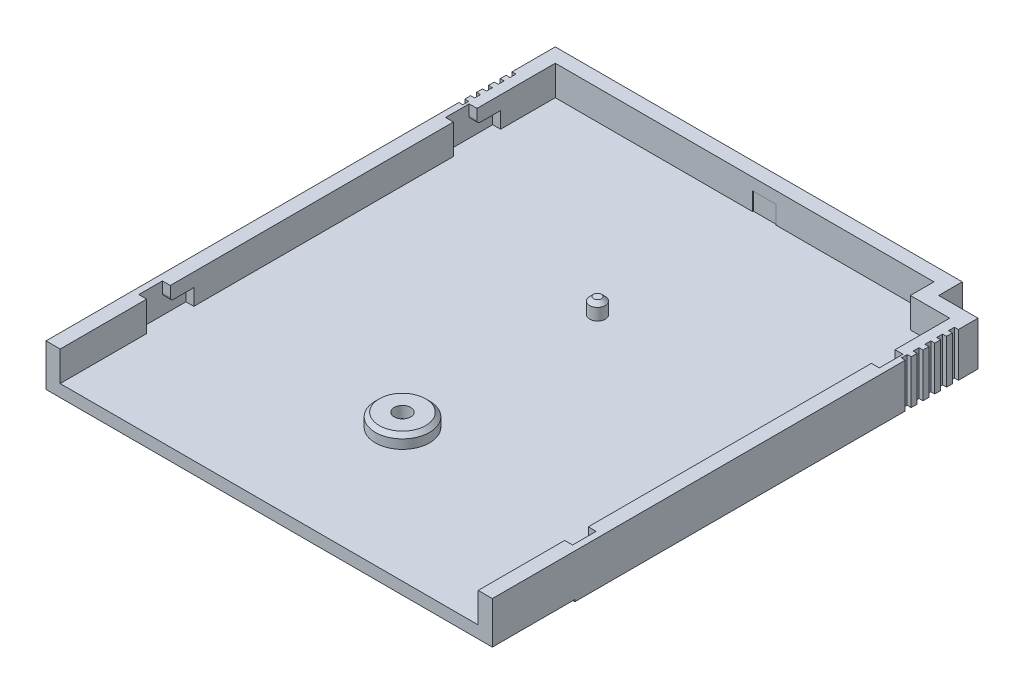
from build123d import *

# Parameters (mm, degrees)
BOSS_EXTRUDE1_DEPTH  = 5.6
SHELL1_T             = -1.8
CUT_EXTRUDE1_REACH   = 72.916
SKETCH2_W            = 53.15
SKETCH2_H            = 3.8
SKETCH3_W            = 0.5
SKETCH3_H            = 0.75
CUT_EXTRUDE2_DEPTH   = 5.6
LPATTERN1_COUNT      = 5
LPATTERN1_PITCH      = 1.5
SKETCH4_R            = 3.45
SKETCH4_R_2          = 1.05
BOSS_EXTRUDE2_DEPTH  = 1.66
SKETCH5_R            = 1
BOSS_EXTRUDE3_DEPTH  = 2
CHAMFER1_SIZE        = 0.5
SKETCH6_R            = 2.5
CUT_EXTRUDE3_DEPTH   = 2
CUT_EXTRUDE4_DEPTH   = 1
LPATTERN2_COUNT      = 2
LPATTERN2_PITCH      = 39
MIRROR1_COPY_1_DEPTH = 1
SKETCH8_W            = 56.75
SKETCH8_H            = 10.5
CUT_EXTRUDE5_DEPTH   = 0.25
SKETCH9_W            = 3
SKETCH9_H            = 54.25
CUT_EXTRUDE6_DEPTH   = 0.1
SKETCH10_W           = 20
SKETCH10_H           = 3
CUT_EXTRUDE7_DEPTH   = 0.1
SKETCH11_W           = 3
SKETCH11_H           = 2.3
CUT_EXTRUDE8_DEPTH   = 0.1


with BuildPart() as part:
    # Sketch1 → Boss-Extrude1 (new body)
    with BuildSketch(Plane(origin=(0, 0, 0), x_dir=(1, 0, 0), z_dir=(0, 1, 0))):
        Polygon((23.375, 32.375), (-28.375, 32.375), (-28.375, -32.375), (28.375, -32.375), (28.375, 29.375), (23.375, 29.375), align=None)
    extrude(amount=BOSS_EXTRUDE1_DEPTH)

    # Shell1
    shell1_openings = [part.faces().sort_by_distance(p)[0] for p in [
        (-0.10605776, 5.6, 0.126552013),
    ]]
    offset(amount=SHELL1_T, openings=shell1_openings, kind=Kind.INTERSECTION)

    # Sketch2 → Cut-Extrude1 (cut, up to next)
    with BuildSketch(Plane.XY.offset(32.375), mode=Mode.PRIVATE) as cut_extrude1_sk1:
        with Locations((0, 3.7)):
            Rectangle(SKETCH2_W, SKETCH2_H)
    cut_extrude1_tool1 = extrude(cut_extrude1_sk1.sketch, amount=-CUT_EXTRUDE1_REACH, mode=Mode.PRIVATE) & part.part
    add(cut_extrude1_tool1.solids().sort_by_distance((0, 3.7, 32.375))[0], mode=Mode.SUBTRACT)

    # Sketch3 → Cut-Extrude2 (cut)
    with BuildSketch(Plane.XZ):
        with Locations((-28.125, -26.5)):
            Rectangle(SKETCH3_W, SKETCH3_H)
        with Locations((28.125, -26.5)):
            Rectangle(SKETCH3_W, SKETCH3_H)
    cut_extrude2 = extrude(amount=-CUT_EXTRUDE2_DEPTH, mode=Mode.SUBTRACT)

    # LPattern1: Cut-Extrude2 ×5
    with Locations(*[(0, 0, i * LPATTERN1_PITCH) for i in range(1, LPATTERN1_COUNT)]):
        add(cut_extrude2, mode=Mode.SUBTRACT)

    # Sketch4 → Boss-Extrude2 (add)
    with BuildSketch(Plane(origin=(0, 1.8, 0), x_dir=(1, 0, 0), z_dir=(0, 1, 0))):
        with Locations(Location((0, -15.425, 0), (0, 0, 90))):
            Circle(SKETCH4_R)
        with Locations(Location((0, -15.425, 0), (0, 0, 90))):
            Circle(SKETCH4_R_2, mode=Mode.SUBTRACT)
    extrude(amount=BOSS_EXTRUDE2_DEPTH)

    # Sketch5 → Boss-Extrude3 (add)
    with BuildSketch(Plane(origin=(0, 1.8, 0), x_dir=(1, 0, 0), z_dir=(0, 1, 0))):
        with Locations(Location((0, 9.375, 0), (0, 0, 90))):
            Circle(SKETCH5_R)
    extrude(amount=BOSS_EXTRUDE3_DEPTH)

    # Chamfer1
    chamfer1_edges = [part.edges().sort_by_distance(p)[0] for p in [
        (0, 3.46, 18.875),
        (0, 3.8, -8.375),
    ]]
    chamfer(chamfer1_edges, length=CHAMFER1_SIZE)

    # Sketch6 → Cut-Extrude3 (cut)
    with BuildSketch(Plane.XZ):
        with Locations(Location((0, 15.425, 0), (0, 0, 270))):
            Circle(SKETCH6_R)
    extrude(amount=-CUT_EXTRUDE3_DEPTH, mode=Mode.SUBTRACT)

    # Sketch7 → Cut-Extrude4 (cut)
    with BuildSketch(Plane.ZY.offset(-26.575)):
        with BuildLine():
            Line((15.375, 3.866149972), (15.375, 1.8))
            Line((15.375, 1.8), (21.375, 1.8))
            Line((21.375, 1.8), (21.375, 5.6))
            Line((21.375, 5.6), (18.375, 5.6))
            Line((18.375, 5.6), (18.375, 4.266149972))
            ThreePointArc((18.375, 4.266149972), (18.257842712, 3.98330726), (17.975, 3.866149972))
            Line((17.975, 3.866149972), (15.375, 3.866149972))
        make_face()
    cut_extrude4 = extrude(amount=-CUT_EXTRUDE4_DEPTH, mode=Mode.SUBTRACT)

    # LPattern2: Cut-Extrude4 ×2
    with Locations(*[(0, 0, -i * LPATTERN2_PITCH) for i in range(1, LPATTERN2_COUNT)]):
        add(cut_extrude4, mode=Mode.SUBTRACT)

    # Mirror1: Cut-Extrude4 across plane
    add(cut_extrude4.mirror(Plane(origin=(0, 0, 0), x_dir=(0, 0, 1), z_dir=(1, 0, 0))), mode=Mode.SUBTRACT)

    # Mirror1 copy 1 sketch → Mirror1 copy 1 (cut)
    with BuildSketch(Plane(origin=(-26.575, 0, -39), x_dir=(0, 0, 1), z_dir=(1, 0, 0))):
        with BuildLine():
            Line((15.375, -3.866149972), (15.375, -1.8))
            Line((15.375, -1.8), (21.375, -1.8))
            Line((21.375, -1.8), (21.375, -5.6))
            Line((21.375, -5.6), (18.375, -5.6))
            Line((18.375, -5.6), (18.375, -4.266149972))
            ThreePointArc((18.375, -4.266149972), (18.257842712, -3.98330726), (17.975, -3.866149972))
            Line((17.975, -3.866149972), (15.375, -3.866149972))
        make_face()
    extrude(amount=-MIRROR1_COPY_1_DEPTH, mode=Mode.SUBTRACT)

    # Sketch8 → Cut-Extrude5 (cut)
    with BuildSketch(Plane.XZ):
        with Locations((0, 27.125)):
            Rectangle(SKETCH8_W, SKETCH8_H)
    extrude(amount=-CUT_EXTRUDE5_DEPTH, mode=Mode.SUBTRACT)

    # Sketch9 → Cut-Extrude6 (cut)
    with BuildSketch(Plane.XZ):
        with Locations((14.875, -5.25)):
            Rectangle(SKETCH9_W, SKETCH9_H)
    cut_extrude6 = extrude(amount=-CUT_EXTRUDE6_DEPTH, mode=Mode.SUBTRACT)

    # Mirror2: Cut-Extrude6 across plane
    add(cut_extrude6.mirror(Plane(origin=(0, 0, 0), x_dir=(0, 0, 1), z_dir=(1, 0, 0))), mode=Mode.SUBTRACT)

    # Sketch10 → Cut-Extrude7 (cut)
    with BuildSketch(Plane.XZ):
        with Locations((0, -28.875)):
            Rectangle(SKETCH10_W, SKETCH10_H)
    extrude(amount=-CUT_EXTRUDE7_DEPTH, mode=Mode.SUBTRACT)

    # Sketch11 → Cut-Extrude8 (cut)
    with BuildSketch(Plane.XY.offset(-30.575)):
        with Locations((0, 2.95)):
            Rectangle(SKETCH11_W, SKETCH11_H)
    extrude(amount=-CUT_EXTRUDE8_DEPTH, mode=Mode.SUBTRACT)


solid = part.part
